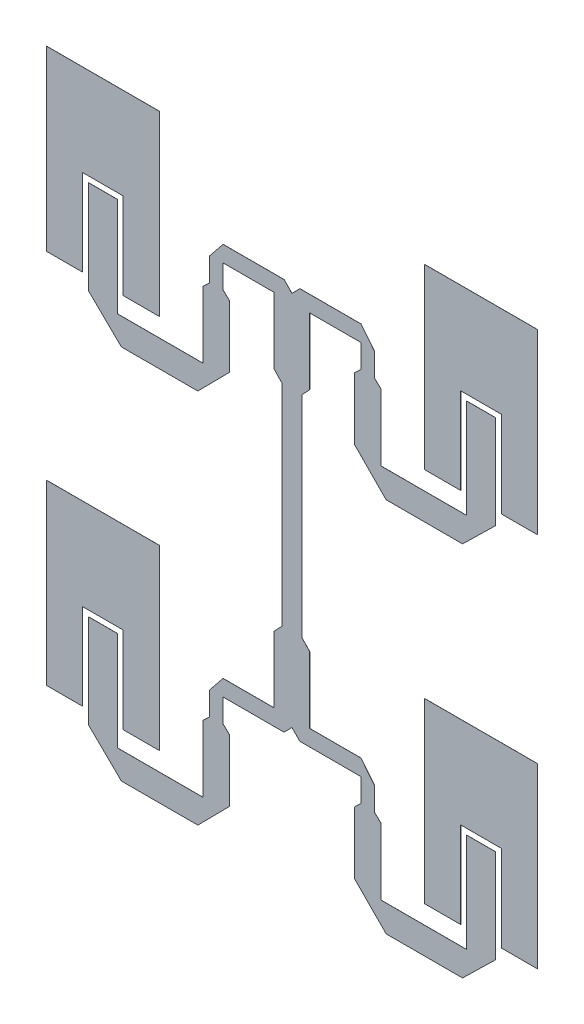
from build123d import *

# Parameters (mm, degrees)
FEED_DEPTH    = 0.018
PATCH_DEPTH   = 0.018
PATCH_2_DEPTH = 0.018
PATCH_3_DEPTH = 0.018
PATCH_4_DEPTH = 0.018


with BuildPart() as part:
    # Feed1 → Feed (new body)
    with BuildSketch(Plane.XY):
        Polygon((-49.47285, 43.6499), (-42.44975, 43.6499), (-42.44975, 19.558), (-21.64715, 19.558), (-21.64715, 35.7378), (-20.04695, 37.2491), (-20.04695, 42.9387), (-16.75765, 47.0281), (-1.91135, 47.0281), (0, 45.0723), (1.91135, 47.0281), (16.75765, 47.0281), (20.04695, 42.9387), (20.04695, 37.2491), (21.64715, 35.7378), (21.64715, 19.558), (42.44975, 19.558), (42.44975, 43.6499), (49.47285, 43.6499), (49.47285, 20.8915), (41.47185, 13.0683), (22.89175, 13.0683), (15.15745, 20.8915), (15.15745, 35.9156), (16.75765, 37.4269), (16.75765, 43.1165), (4.31165, 43.1165), (4.31165, 26.9367), (2.44475, 24.9809), (2.44475, -26.2255), (4.31165, -28.1813), (4.31165, -44.3611), (16.75765, -44.3611), (20.04695, -48.4505), (20.04695, -54.1401), (21.64715, -55.6514), (21.64715, -71.8312), (42.44975, -71.8312), (42.44975, -47.7393), (49.47285, -47.7393), (49.47285, -70.4977), (41.47185, -78.3209), (22.89175, -78.3209), (15.15745, -70.4977), (15.15745, -55.4736), (16.75765, -53.9623), (16.75765, -48.2727), (1.91135, -48.2727), (0, -46.3169), (-1.91135, -48.2727), (-16.75765, -48.2727), (-16.75765, -53.9623), (-15.15745, -55.4736), (-15.15745, -70.4977), (-22.89175, -78.3209), (-41.47185, -78.3209), (-49.47285, -70.4977), (-49.47285, -47.7393), (-42.44975, -47.7393), (-42.44975, -71.8312), (-21.64715, -71.8312), (-21.64715, -55.6514), (-20.04695, -54.1401), (-20.04695, -48.4505), (-16.75765, -44.3611), (-4.31165, -44.3611), (-4.31165, -28.1813), (-2.44475, -26.2255), (-2.44475, 24.9809), (-4.31165, 26.9367), (-4.31165, 43.1165), (-16.75765, 43.1165), (-16.75765, 37.4269), (-15.15745, 35.9156), (-15.15745, 20.8915), (-22.89175, 13.0683), (-41.47185, 13.0683), (-49.47285, 20.8915), align=None)
    extrude(amount=FEED_DEPTH)


with BuildPart() as body_2:
    # Patch1 → Patch (new body)
    with BuildSketch(Plane.XY):
        Polygon((-59.69635, 67.2973), (-32.22625, 67.2973), (-32.22625, 24.0919), (-41.02735, 24.0919), (-41.02735, 45.0723), (-50.89525, 45.0723), (-50.89525, 24.0919), (-59.69635, 24.0919), align=None)
    extrude(amount=PATCH_DEPTH)


with BuildPart() as body_3:
    # Patch1 → Patch 2 (new body)
    with BuildSketch(Plane.XY):
        Polygon((41.02735, 24.0919), (32.22625, 24.0919), (32.22625, 67.2973), (59.69635, 67.2973), (59.69635, 24.0919), (50.89525, 24.0919), (50.89525, 45.0723), (41.02735, 45.0723), align=None)
    extrude(amount=PATCH_2_DEPTH)


with BuildPart() as body_4:
    # Patch1 → Patch 3 (new body)
    with BuildSketch(Plane.XY):
        Polygon((-41.02735, -67.2973), (-32.22625, -67.2973), (-32.22625, -24.0919), (-59.69635, -24.0919), (-59.69635, -67.2973), (-50.89525, -67.2973), (-50.89525, -46.3169), (-41.02735, -46.3169), align=None)
    extrude(amount=PATCH_3_DEPTH)


with BuildPart() as body_5:
    # Patch1 → Patch 4 (new body)
    with BuildSketch(Plane.XY):
        Polygon((59.69635, -67.2973), (50.89525, -67.2973), (50.89525, -46.3169), (41.02735, -46.3169), (41.02735, -67.2973), (32.22625, -67.2973), (32.22625, -24.0919), (59.69635, -24.0919), align=None)
    extrude(amount=PATCH_4_DEPTH)


solid = Compound([part.part, body_2.part, body_3.part, body_4.part, body_5.part])
